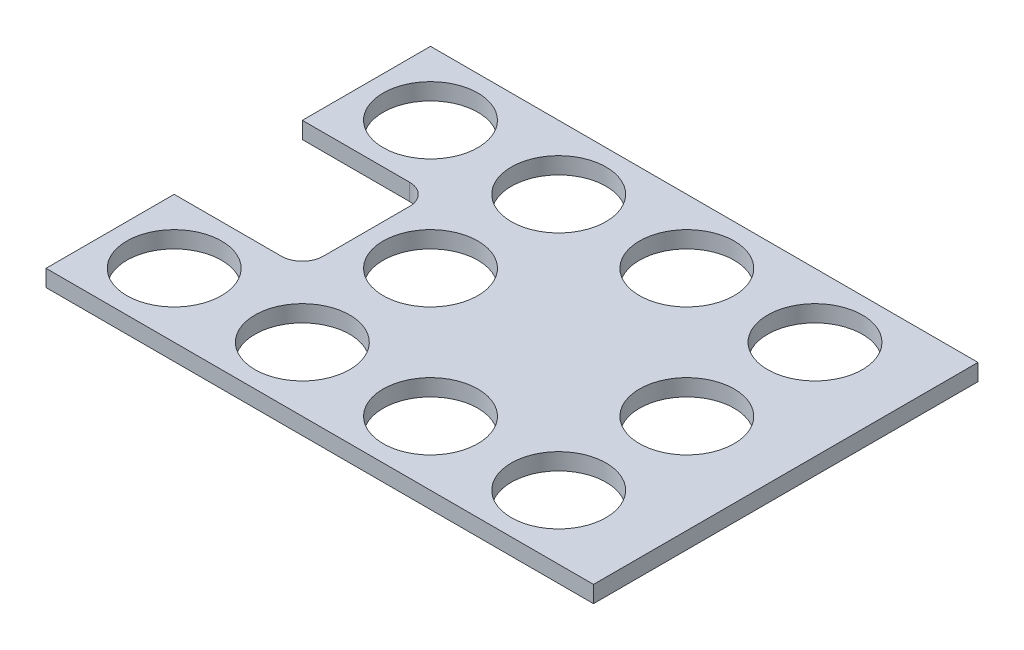
from build123d import *

# Parameters (mm, degrees)
SKETCH1_W           = 393
SKETCH1_H           = 276
BOSS_EXTRUDE1_DEPTH = 12
SKETCH1_3_R         = 34
CUT_EXTRUDE1_DEPTH  = 12
LPATTERN1_COUNT     = 4
LPATTERN1_PITCH     = 92
SKETCH1_4_R         = 34
CUT_EXTRUDE3_DEPTH  = 12


with BuildPart() as part:
    # Sketch1 → Boss-Extrude1 (new body)
    with BuildSketch(Plane(origin=(0, 0, 0), x_dir=(1, 0, 0), z_dir=(0, 1, 0))):
        with Locations((196.5, 138)):
            Rectangle(SKETCH1_W, SKETCH1_H)
    extrude(amount=BOSS_EXTRUDE1_DEPTH)

    # Sketch1<3> → Cut-Extrude1 (cut)
    with BuildSketch(Plane(origin=(0, 0, 0), x_dir=(1, 0, 0), z_dir=(0, 1, 0))):
        with Locations(Location((46, 46, 0), (0, 0, 270))):
            Circle(SKETCH1_3_R)
        with Locations(Location((46, 230, 0), (0, 0, 270))):
            Circle(SKETCH1_3_R)
    cut_extrude1 = extrude(amount=CUT_EXTRUDE1_DEPTH, mode=Mode.SUBTRACT)

    # LPattern1: Cut-Extrude1 ×4
    with Locations(*[(i * LPATTERN1_PITCH, 0, 0) for i in range(1, LPATTERN1_COUNT)]):
        add(cut_extrude1, mode=Mode.SUBTRACT)

    # Sketch1<4> → Cut-Extrude3 (cut)
    with BuildSketch(Plane(origin=(0, 0, 0), x_dir=(1, 0, 0), z_dir=(0, 1, 0))):
        with BuildLine():
            Line((0, 184), (0, 92))
            Line((0, 92), (77, 92))
            ThreePointArc((77, 92), (87.606601718, 96.393398282), (92, 107))
            Line((92, 107), (92, 169))
            ThreePointArc((92, 169), (87.606601718, 179.606601718), (77, 184))
            Line((77, 184), (0, 184))
        make_face()
        with Locations(Location((138, 138, 0), (0, 0, 90))):
            Circle(SKETCH1_4_R)
        with Locations(Location((322, 138, 0), (0, 0, 90))):
            Circle(SKETCH1_4_R)
    extrude(amount=CUT_EXTRUDE3_DEPTH, mode=Mode.SUBTRACT)


solid = part.part
